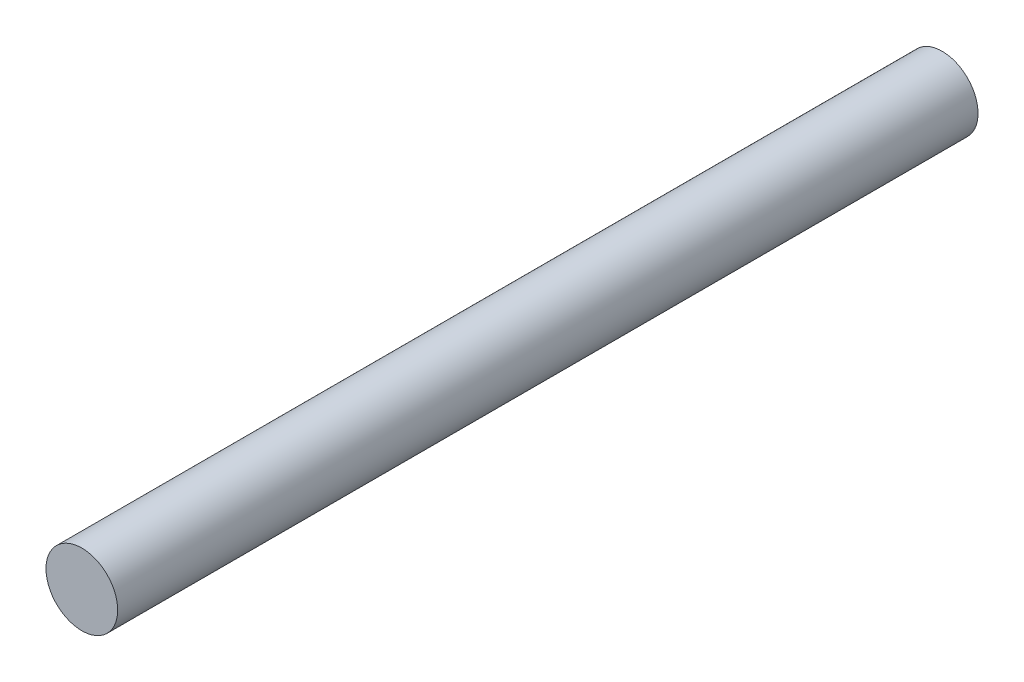
from build123d import *

# Parameters (mm, degrees)
SKETCH1_R           = 6.35
BOSS_EXTRUDE1_DEPTH = 152.4


with BuildPart() as part:
    # Sketch1 → Boss-Extrude1 (new body)
    with BuildSketch(Plane.XY):
        with Locations(Location((0, 0, 0), (0, 0, 180))):
            Circle(SKETCH1_R)
    extrude(amount=BOSS_EXTRUDE1_DEPTH)


solid = part.part
